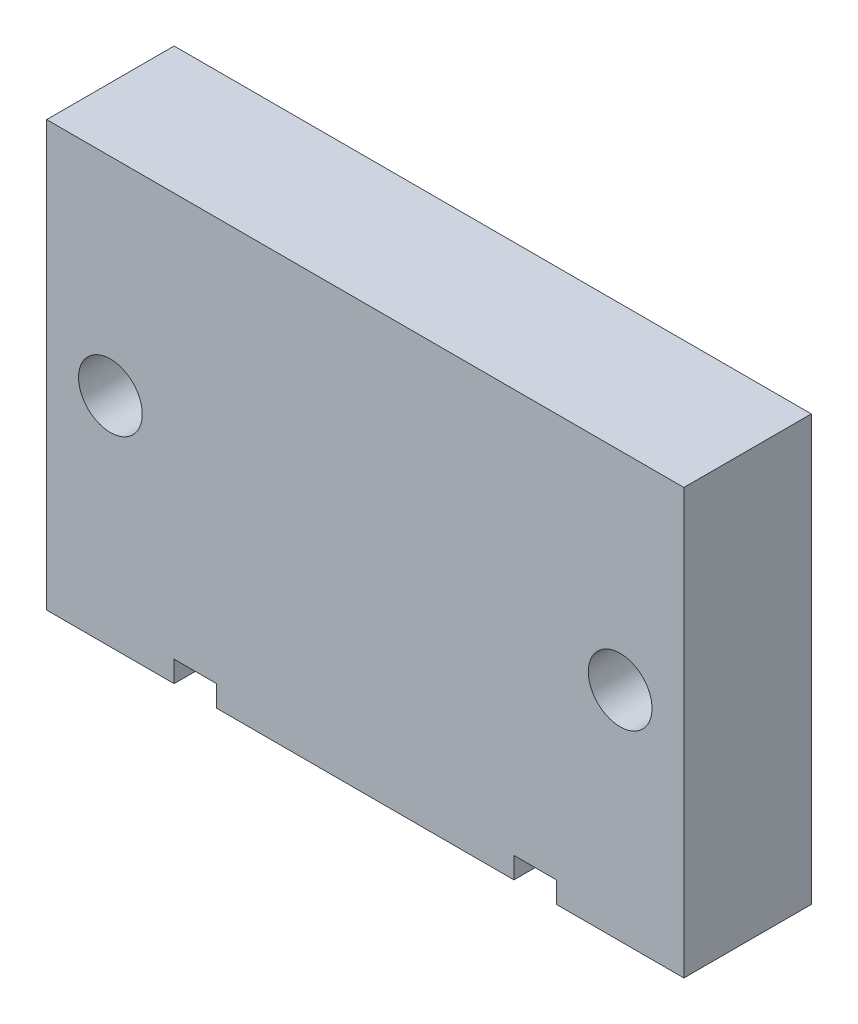
from build123d import *

# Parameters (mm, degrees)
CROQUIS1_W                 = 15
CROQUIS1_H                 = 10
SALIENTE_EXTRUIR1_DEPTH    = 1.5
CORTAR_EXTRUIR2_DEPTH      = 1
CORTAR_EXTRUIR2_DEPTH_BACK = 13.589678312
CROQUIS4_W                 = 1
CROQUIS4_H                 = 3
CORTAR_EXTRUIR3_DEPTH      = 0.5
CROQUIS6_R                 = 0.75
CORTAR_EXTRUIR6_DEPTH      = 13.854960132


with BuildPart() as part:
    # Croquis1 → Saliente-Extruir1 (new, symmetric)
    with BuildSketch(Plane.XY):
        with Locations((0, 5)):
            Rectangle(CROQUIS1_W, CROQUIS1_H)
    extrude(amount=SALIENTE_EXTRUIR1_DEPTH, both=True)

    # Croquis3 → Cortar-Extruir2 (cut, two sides: drawn at the far end of the back side and taken through both)
    with BuildSketch(Plane.XY.offset(-CORTAR_EXTRUIR2_DEPTH_BACK)):
        Polygon((3.290896534, 5.12), (1.645448267, 7.97), (-1.645448267, 7.97), (-3.290896534, 5.12), (-1.645448267, 2.27), (1.645448267, 2.27), align=None)
    extrude(amount=CORTAR_EXTRUIR2_DEPTH + CORTAR_EXTRUIR2_DEPTH_BACK, mode=Mode.SUBTRACT)

    # Croquis4 → Cortar-Extruir3 (cut)
    with BuildSketch(Plane.XZ):
        with Locations((-4, 0)):
            Rectangle(CROQUIS4_W, CROQUIS4_H)
        with Locations((4, 0)):
            Rectangle(CROQUIS4_W, CROQUIS4_H)
    extrude(amount=-CORTAR_EXTRUIR3_DEPTH, mode=Mode.SUBTRACT)

    # Croquis6 → Cortar-Extruir6 (cut, through all)
    with BuildSketch(Plane(origin=(0, 0, -1.5), x_dir=(-1, 0, 0), z_dir=(0, 0, -1))):
        with Locations((-6, 5.12)):
            Circle(CROQUIS6_R)
        with Locations((6, 5.12)):
            Circle(CROQUIS6_R)
    extrude(amount=-CORTAR_EXTRUIR6_DEPTH, mode=Mode.SUBTRACT)


solid = part.part
